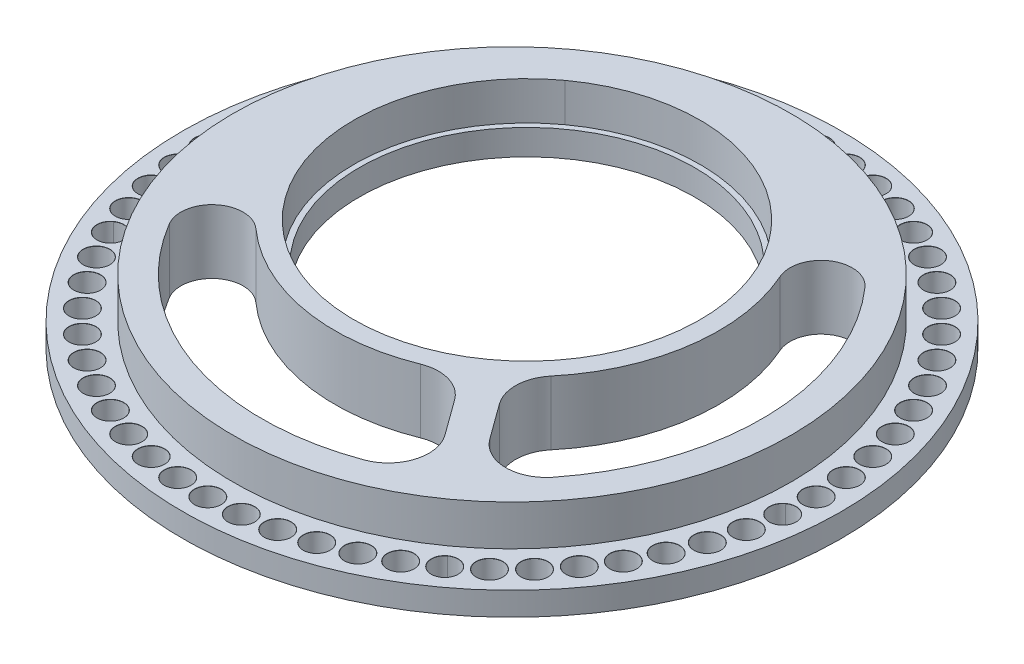
from build123d import *

# Parameters (mm, degrees)
SLOTTED_BODY_EXTRUDE_DEPTH      = 4.191
SLOTTED_BODY_EXTRUDE_DEPTH_BACK = 0.2032
SKETCH1_R                       = 61.9125
SKETCH1_R_2                     = 30.988
SKETCH5_R                       = 52.3875
BOSS_EXTRUDE3_DEPTH             = 7.62
SKETCH6_R                       = 32.512
CUT_EXTRUDE5_DEPTH              = 89.377917571
SKETCH8_R                       = 32.512
SKETCH8_R_2                     = 31.496
BOSS_EXTRUDE4_DEPTH             = 4.795000062
CIRPATTERN1_COUNT               = 60
BODY_MOVE_COPY1_ANGLE           = 144


with BuildPart() as part:
    # Sketch1 → Slotted-Body Extrude (new, two sides: drawn at the far end of the back side and taken through both)
    with BuildSketch(Plane(origin=(0, 0, 0), x_dir=(1, 0, 0), z_dir=(0, 1, 0)).offset(-SLOTTED_BODY_EXTRUDE_DEPTH_BACK)):
        with Locations(Location((0, 0, 0), (0, 0, 270))):
            Circle(SKETCH1_R)
        with Locations(Location((0, -12.7, 0), (0, 0, 270))):
            Circle(SKETCH1_R_2, mode=Mode.SUBTRACT)
    extrude(amount=SLOTTED_BODY_EXTRUDE_DEPTH + SLOTTED_BODY_EXTRUDE_DEPTH_BACK)

    # Sketch5 → Boss-Extrude3 (add)
    with BuildSketch(Plane(origin=(0, 4.191, 0), x_dir=(1, 0, 0), z_dir=(0, 1, 0))):
        with Locations(Location((0, 0, 0), (0, 0, 90))):
            Circle(SKETCH5_R)
    extrude(amount=BOSS_EXTRUDE3_DEPTH)

    # Sketch6 → Cut-Extrude5 (cut, through all)
    with BuildSketch(Plane.XZ.offset(0.2032)):
        with Locations(Location((0, 12.7, 0), (0, 0, 270))):
            Circle(SKETCH6_R)
        with BuildLine():
            Line((3.013951015, -37.906674687), (3.013951015, -29.674053734))
            ThreePointArc((3.013951015, -29.674053734), (4.62572071, -24.987309811), (8.779192117, -22.283230408))
            ThreePointArc((8.779192117, -22.283230408), (25.925135322, -12.375645206), (35.256203169, 5.09074497))
            ThreePointArc((35.256203169, 5.09074497), (41.313127715, 9.689980346), (46.782976949, 4.406037654))
            ThreePointArc((46.782976949, 4.406037654), (38.737451576, -26.59830719), (12.692135082, -45.243450433))
            ThreePointArc((12.692135082, -45.243450433), (6.03063496, -43.979061474), (3.013951015, -37.906674687))
        make_face()
        with BuildLine():
            Line((-3.013951015, -37.906674687), (-3.013951015, -29.674053734))
            ThreePointArc((-3.013951015, -29.674053734), (-4.62572071, -24.987309811), (-8.779192117, -22.283230408))
            ThreePointArc((-8.779192117, -22.283230408), (-25.925135322, -12.375645206), (-35.256203169, 5.09074497))
            ThreePointArc((-35.256203169, 5.09074497), (-41.313127715, 9.689980346), (-46.782976949, 4.406037654))
            ThreePointArc((-46.782976949, 4.406037654), (-38.737451576, -26.59830719), (-12.692135082, -45.243450433))
            ThreePointArc((-12.692135082, -45.243450433), (-6.03063496, -43.979061474), (-3.013951015, -37.906674687))
        make_face()
    extrude(amount=-CUT_EXTRUDE5_DEPTH, mode=Mode.SUBTRACT)

    # Sketch10 → Ø5.0mm Dowel Hole2 (revolve, cut)
    with BuildSketch(Plane(origin=(0, 4.191, -57.15), x_dir=(0, 0, 1), z_dir=(1, 0, 0))):
        Polygon((0, 0), (0, 4.3942), (2.5, 4.3942), (2.5, 0.025), (2.525, 0), align=None)
    f_5_0mm_dowel_hole2 = revolve(axis=Axis((0, 10.541, -57.15), (0, -1, 0)), mode=Mode.SUBTRACT)

    # CirPattern1: Ø5.0mm Dowel Hole2 ×60 about axis
    cirpattern1_axis = Axis((0, 0, 0), (0, 1, 0))
    for i in range(1, CIRPATTERN1_COUNT):
        add(f_5_0mm_dowel_hole2.rotate(cirpattern1_axis, i * 360 / CIRPATTERN1_COUNT), mode=Mode.SUBTRACT)


with BuildPart() as body_2:
    # Sketch8 → Boss-Extrude4 (new body)
    with BuildSketch(Plane.XZ.offset(0.2032)):
        with Locations(Location((0, 12.7, 0), (0, 0, 270))):
            Circle(SKETCH8_R)
        with Locations(Location((0, 12.7, 0), (0, 0, 270))):
            Circle(SKETCH8_R_2, mode=Mode.SUBTRACT)
    extrude(amount=-BOSS_EXTRUDE4_DEPTH)


with BuildPart() as body_2_1:
    # Body-Move/Copy1: moved
    add(body_2.part.rotate(Axis((0, 0, 0), (0, -1, 0)), BODY_MOVE_COPY1_ANGLE))


with BuildPart() as part_1:
    # Body-Move/Copy1: moved
    add(part.part.rotate(Axis((0, 0, 0), (0, -1, 0)), BODY_MOVE_COPY1_ANGLE))


solid = Compound([body_2_1.part, part_1.part])
